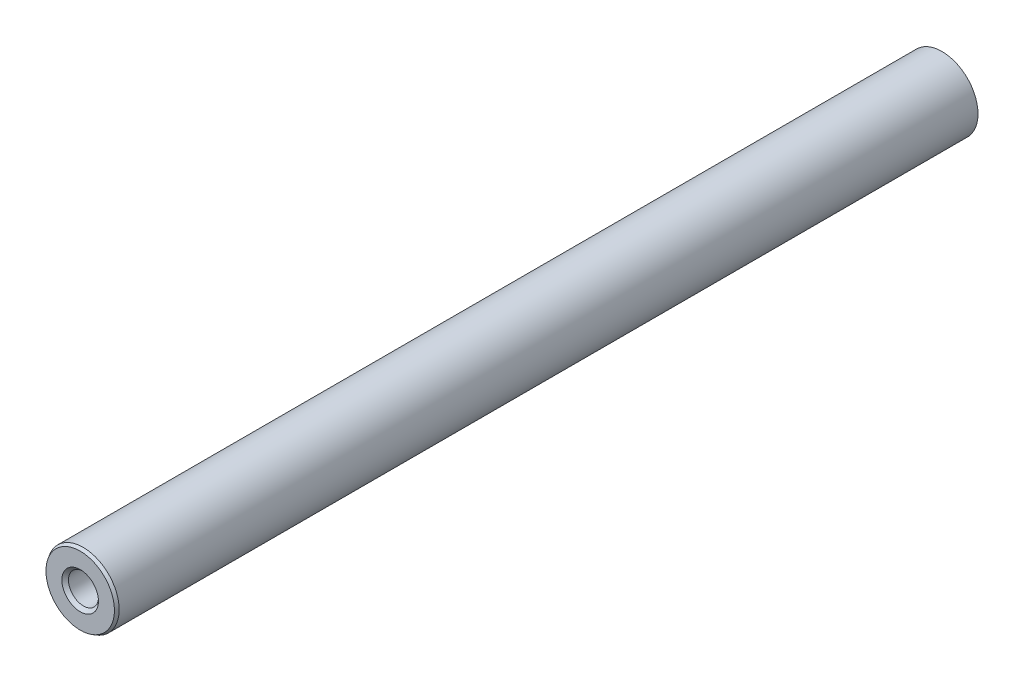
from build123d import *
from OCP.BRepFilletAPI import BRepFilletAPI_MakeChamfer

# Parameters (mm, degrees)
SKETCH_1_R      = 3
EXTRUDE_1_DEPTH = 36
CHAMFER_1_SIZE  = 0.25
CHAMFER_1_SIZE2 = 0.144337567


with BuildPart() as part:
    # ｽｹｯﾁ1 → ﾎﾞｽ - 押し出し1 (new, symmetric)
    with BuildSketch(Plane.XY):
        Circle(SKETCH_1_R)
    extrude(amount=EXTRUDE_1_DEPTH, both=True)

    # 面取り1: one chamfer whose edges measure the first distance from different faces: ONE call of the kernel's chamfer builder (chamfer() names one face for all edges)
    chamfer_1_edges_1 = [part.edges().sort_by_distance(p)[0] for p in [
        (-3, 0, -36),
    ]]
    chamfer_1_side_1 = [part.faces().sort_by_distance(p)[0] for p in [
        (0, 0, -36),
    ]]
    chamfer_1_edges_2 = [part.edges().sort_by_distance(p)[0] for p in [
        (-3, 0, 36),
    ]]
    chamfer_1_side_2 = [part.faces().sort_by_distance(p)[0] for p in [
        (-3, 0, 0),
    ]]
    chamfer_1 = BRepFilletAPI_MakeChamfer(part.part.solid().wrapped)
    for e in chamfer_1_edges_1:
        chamfer_1.Add(CHAMFER_1_SIZE, CHAMFER_1_SIZE2, e.wrapped, chamfer_1_side_1[0].wrapped)  # the first distance lies on this face
    for e in chamfer_1_edges_2:
        chamfer_1.Add(CHAMFER_1_SIZE, CHAMFER_1_SIZE2, e.wrapped, chamfer_1_side_2[0].wrapped)  # the first distance lies on this face
    add(Compound.cast(chamfer_1.Shape()), mode=Mode.REPLACE)

    # ｽｹｯﾁ3 → M3x0.5 ねじ穴1 (revolve, cut)
    with BuildSketch(Plane(origin=(0, 0, 36), x_dir=(0, -1, 0), z_dir=(1, 0, 0))):
        Polygon((0, 0), (0, 13.251075774), (1.25, 12.5), (1.25, 0.275), (1.525, 0), align=None)
    m3x0_5_1 = revolve(axis=Axis((0, 0, 42.35), (0, 0, -1)), mode=Mode.SUBTRACT)

    # ﾐﾗｰ1: M3x0.5 ねじ穴1 across plane
    add(m3x0_5_1.mirror(Plane.XY), mode=Mode.SUBTRACT)


solid = part.part
